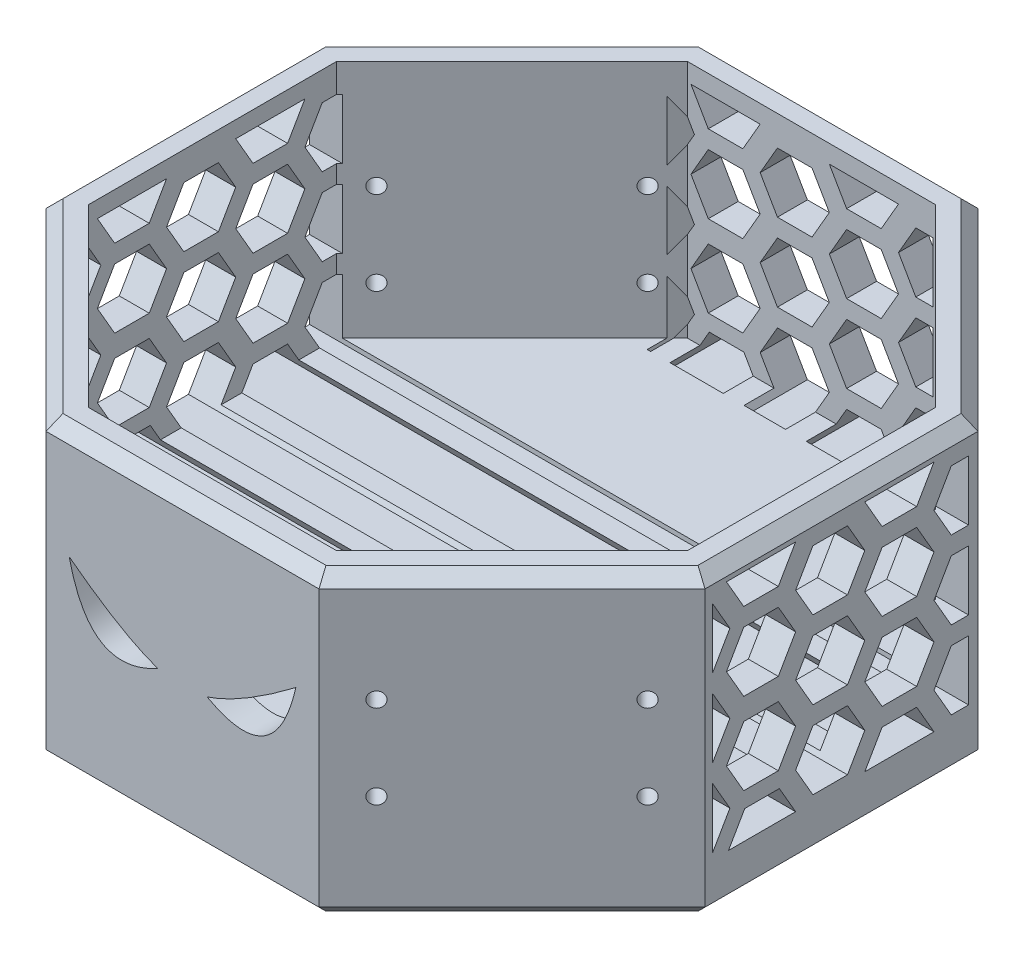
from build123d import *

# Parameters (mm, degrees)
RESSALTO_EXTRUS_O1_DEPTH                = 50
CORTE_EXTRUS_O2_DEPTH                   = 40
BROCA_DE_ROSQUEAR_PARA_TARRAXA_DE_M31_D = 2.5
BROCA_DE_ROSQUEAR_PARA_TARRAXA_DE_M32_D = 2.5
CHANFRO1_SIZE                           = 2
CORTE_EXTRUS_O3_DEPTH                   = 133.759180474
CORTE_EXTRUS_O4_DEPTH                   = 10
CORTE_EXTRUS_O5_DEPTH                   = 10


with BuildPart() as part:
    # Esboço1 → Ressalto-extrusão1 (new body)
    with BuildSketch(Plane(origin=(0, 0, 0), x_dir=(1, 0, 0), z_dir=(0, 1, 0))):
        Polygon((55, -22.781745931), (55, 22.781745931), (22.781745931, 55), (-22.781745931, 55), (-55, 22.781745931), (-55, -22.781745931), (-22.781745931, -55), (22.781745931, -55), align=None)
    extrude(amount=RESSALTO_EXTRUS_O1_DEPTH)

    # Esboço2 → Corte-extrusão2 (cut)
    with BuildSketch(Plane(origin=(0, 50, 0), x_dir=(1, 0, 0), z_dir=(0, 1, 0))):
        Polygon((50, 20.710678119), (20.710678119, 50), (-20.710678119, 50), (-50, 20.710678119), (-50, -20.710678119), (-20.710678119, -50), (20.710678119, -50), (50, -20.710678119), align=None)
    extrude(amount=-CORTE_EXTRUS_O2_DEPTH, mode=Mode.SUBTRACT)

    # Broca de rosquear para tarraxa de M31 (through all)
    with Locations(Plane(origin=(38.890872965, 0, 38.890872965), x_dir=(0.7071067811865479, 0, -0.7071067811865472), z_dir=(0.7071067811865472, 0, 0.7071067811865479))):
        with Locations((-16, 32), (16, 32), (-16, 18), (16, 18)):
            Hole(BROCA_DE_ROSQUEAR_PARA_TARRAXA_DE_M31_D / 2)

    # Broca de rosquear para tarraxa de M32 (through all)
    with Locations(Plane(origin=(-38.890872965, 0, 38.890872965), x_dir=(0.7071067811865476, 0, 0.7071067811865476), z_dir=(-0.7071067811865476, 0, 0.7071067811865476))):
        with Locations((-16, 32), (16, 32), (-16, 18), (16, 18)):
            Hole(BROCA_DE_ROSQUEAR_PARA_TARRAXA_DE_M32_D / 2)

    # Chanfro1
    chanfro1_edges = [part.edges().sort_by_distance(p)[0] for p in [
        (0, 0, -55),
        (38.890872965, 0, -38.890872965),
        (55, 0, 0),
        (38.890872965, 0, 38.890872965),
        (38.890872965, 50, -38.890872965),
        (0, 50, -55),
        (-38.890872965, 50, -38.890872965),
        (-55, 50, 0),
        (-38.890872965, 50, 38.890872965),
        (0, 50, 55),
        (38.890872965, 50, 38.890872965),
        (0, 0, 55),
        (55, 50, 0),
        (-38.890872965, 0, 38.890872965),
        (-55, 0, 0),
        (-38.890872965, 0, -38.890872965),
    ]]
    chamfer(chanfro1_edges, length=CHANFRO1_SIZE)

    # Esboço11 → Corte-extrusão3 (cut, through all)
    with BuildSketch(Plane.ZY.offset(55)):
        Polygon((18.862017185, 8.239613046), (16.148516283, 12.939534476), (10.375013591, 12.939534476), (7.661512689, 8.239613046), align=None)
        Polygon((7.661512689, 27.239613046), (4.774761343, 32.239613046), (-0.998741349, 32.239613046), (-3.885492695, 27.239613046), (-0.998741349, 22.239613046), (4.774761343, 22.239613046), align=None)
        Polygon((-3.885492695, 21.239613046), (-6.772244041, 26.239613046), (-12.545746733, 26.239613046), (-15.432498079, 21.239613046), (-12.545746733, 16.239613046), (-6.772244041, 16.239613046), align=None)
        Polygon((7.661512689, 40.239613046), (4.774761343, 45.239613046), (-0.998741349, 45.239613046), (-3.885492695, 40.239613046), (-0.998741349, 35.239613046), (4.774761343, 35.239613046), align=None)
        Polygon((7.661512689, 14.239613046), (4.774761343, 19.239613046), (-0.998741349, 19.239613046), (-3.885492695, 14.239613046), (-0.998741349, 9.239613046), (4.774761343, 9.239613046), align=None)
        Polygon((-15.432498079, 8.239613046), (-3.885492695, 8.239613046), (-6.772244041, 13.239613046), (-12.545746733, 13.239613046), align=None)
        Polygon((-15.432498079, 47.239613046), (-3.885492695, 47.239613046), (-6.772244041, 42.239613046), (-12.545746733, 42.239613046), align=None)
        Polygon((-3.885492695, 34.239613046), (-6.772244041, 39.239613046), (-12.545746733, 39.239613046), (-15.432498079, 34.239613046), (-12.545746733, 29.239613046), (-6.772244041, 29.239613046), align=None)
        Polygon((-21.206000771, 45.239613046), (-21.206000771, 35.239613046), (-18.319249425, 35.239613046), (-15.432498079, 40.239613046), (-18.319249425, 45.239613046), align=None)
        Polygon((-15.432498079, 27.239613046), (-18.319249425, 32.239613046), (-21.206000771, 32.239613046), (-21.206000771, 22.239613046), (-18.319249425, 22.239613046), align=None)
        Polygon((-15.432498079, 14.239613046), (-18.319249425, 19.239613046), (-21.206000771, 19.239613046), (-21.206000771, 9.239613046), (-18.319249425, 9.239613046), align=None)
        Polygon((19.208518072, 34.239613046), (16.321766726, 39.239613046), (10.548264034, 39.239613046), (7.661512689, 34.239613046), (10.548264034, 29.239613046), (16.321766726, 29.239613046), align=None)
        Polygon((7.661512689, 47.239613046), (10.548264034, 42.239613046), (16.321766726, 42.239613046), (19.208518072, 47.239613046), align=None)
        Polygon((21.517919149, 45.239613046), (21.517919149, 35.239613046), (18.631167803, 40.239613046), align=None)
        Polygon((19.208518072, 20.602829594), (16.321766726, 25.602829594), (10.548264034, 25.602829594), (7.661512689, 20.602829594), (10.548264034, 15.602829594), (16.321766726, 15.602829594), align=None)
        Polygon((21.517919149, 32.239613046), (21.517919149, 22.239613046), (18.631167803, 27.239613046), align=None)
        Polygon((21.517919149, 19.239613046), (21.517919149, 9.239613046), (18.631167803, 14.239613046), align=None)
    extrude(amount=-CORTE_EXTRUS_O3_DEPTH, mode=Mode.SUBTRACT)

    # Esboço12 → Corte-extrusão4 (cut)
    with BuildSketch(Plane(origin=(0, 0, -55), x_dir=(-1, 0, 0), z_dir=(0, 0, -1))):
        Polygon((19.781745931, 8), (17.068245028, 12.699921429), (11.294742336, 12.699921429), (8.581241434, 8), align=None)
        Polygon((8.581241434, 27), (5.694490088, 32), (-0.079012604, 32), (-2.96576395, 27), (-0.079012604, 22), (5.694490088, 22), align=None)
        Polygon((-2.96576395, 21), (-5.852515296, 26), (-11.626017988, 26), (-14.512769334, 21), (-11.626017988, 16), (-5.852515296, 16), align=None)
        Polygon((8.581241434, 40), (5.694490088, 45), (-0.079012604, 45), (-2.96576395, 40), (-0.079012604, 35), (5.694490088, 35), align=None)
        Polygon((8.581241434, 14), (5.694490088, 19), (-0.079012604, 19), (-2.96576395, 14), (-0.079012604, 9), (5.694490088, 9), align=None)
        Polygon((-14.512769334, 8), (-2.96576395, 8), (-5.852515296, 13), (-11.626017988, 13), align=None)
        Polygon((-14.512769334, 47), (-2.96576395, 47), (-5.852515296, 42), (-11.626017988, 42), align=None)
        Polygon((-2.96576395, 34), (-5.852515296, 39), (-11.626017988, 39), (-14.512769334, 34), (-11.626017988, 29), (-5.852515296, 29), align=None)
        Polygon((-20.286272026, 45), (-20.286272026, 35), (-17.39952068, 35), (-14.512769334, 40), (-17.39952068, 45), align=None)
        Polygon((-14.512769334, 27), (-17.39952068, 32), (-20.286272026, 32), (-20.286272026, 22), (-17.39952068, 22), align=None)
        Polygon((-14.512769334, 14), (-17.39952068, 19), (-20.286272026, 19), (-20.286272026, 9), (-17.39952068, 9), align=None)
        Polygon((20.128246818, 34), (17.241495472, 39), (11.46799278, 39), (8.581241434, 34), (11.46799278, 29), (17.241495472, 29), align=None)
        Polygon((8.581241434, 47), (11.46799278, 42), (17.241495472, 42), (20.128246818, 47), align=None)
        Polygon((22.437647894, 45), (22.437647894, 35), (19.550896548, 40), align=None)
        Polygon((20.128246818, 20.363216547), (17.241495472, 25.363216547), (11.46799278, 25.363216547), (8.581241434, 20.363216547), (11.46799278, 15.363216547), (17.241495472, 15.363216547), align=None)
        Polygon((22.437647894, 32), (22.437647894, 22), (19.550896548, 27), align=None)
        Polygon((22.437647894, 19), (22.437647894, 9), (19.550896548, 14), align=None)
    extrude(amount=-CORTE_EXTRUS_O4_DEPTH, mode=Mode.SUBTRACT)

    # Esboço13 → Corte-extrusão5 (cut)
    with BuildSketch(Plane.XY.offset(55)):
        with BuildLine():
            add(Edge.make_bspline(
                [(-18.917899523, 31.812800079), (-9.790862328, 24.903720312), (-4.10744427, 23.050598788)],
                knots=[0, 0, 0, 1, 1, 1], degree=2))
            add(Edge.make_bspline(
                [(-18.917899523, 31.812800079), (-15.516774887, 16.806948828), (-4.10744427, 23.050598788)],
                knots=[0, 0, 0, 1, 1, 1], degree=2))
        make_face()
        with BuildLine():
            add(Edge.make_bspline(
                [(18.917899523, 31.812800079), (9.790862328, 24.903720312), (4.10744427, 23.050598788)],
                knots=[0, 0, 0, 1, 1, 1], degree=2))
            add(Edge.make_bspline(
                [(18.917899523, 31.812800079), (15.516774887, 16.806948828), (4.10744427, 23.050598788)],
                knots=[0, 0, 0, 1, 1, 1], degree=2))
        make_face()
    extrude(amount=-CORTE_EXTRUS_O5_DEPTH, mode=Mode.SUBTRACT)


solid = part.part
